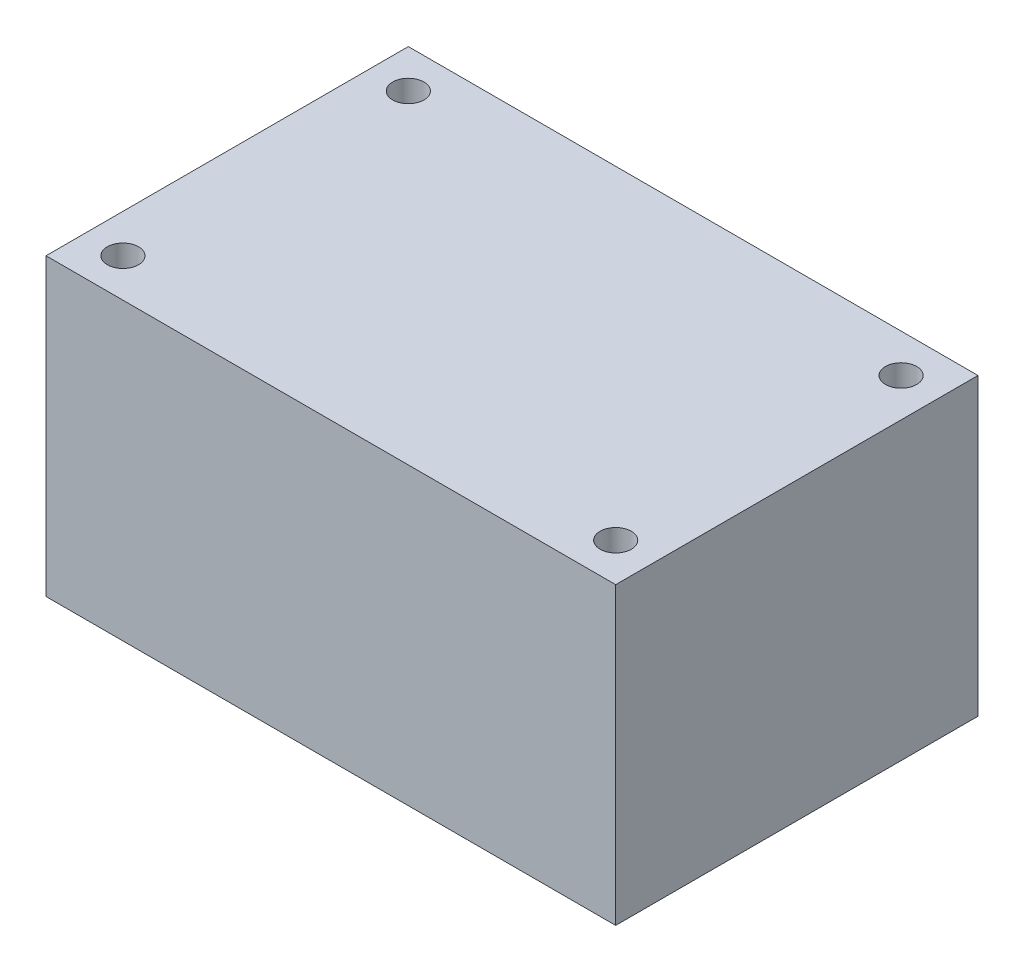
from build123d import *

# Parameters (mm, degrees)
SKETCH1_W           = 57.91
SKETCH1_H           = 36.83
SKETCH1_R           = 1.5875
BOSS_EXTRUDE1_DEPTH = 30


with BuildPart() as part:
    # Sketch1 → Boss-Extrude1 (new body)
    with BuildSketch(Plane(origin=(0, 0, 0), x_dir=(1, 0, 0), z_dir=(0, 1, 0))):
        Rectangle(SKETCH1_W, SKETCH1_H)
        with Locations(Location((-25.045, 14.505, 0), (0, 0, 270))):
            Circle(SKETCH1_R, mode=Mode.SUBTRACT)
        with Locations(Location((25.045, 14.505, 0), (0, 0, 270))):
            Circle(SKETCH1_R, mode=Mode.SUBTRACT)
        with Locations(Location((25.045, -14.505, 0), (0, 0, 270))):
            Circle(SKETCH1_R, mode=Mode.SUBTRACT)
        with Locations(Location((-25.045, -14.505, 0), (0, 0, 270))):
            Circle(SKETCH1_R, mode=Mode.SUBTRACT)
    extrude(amount=BOSS_EXTRUDE1_DEPTH)


solid = part.part
